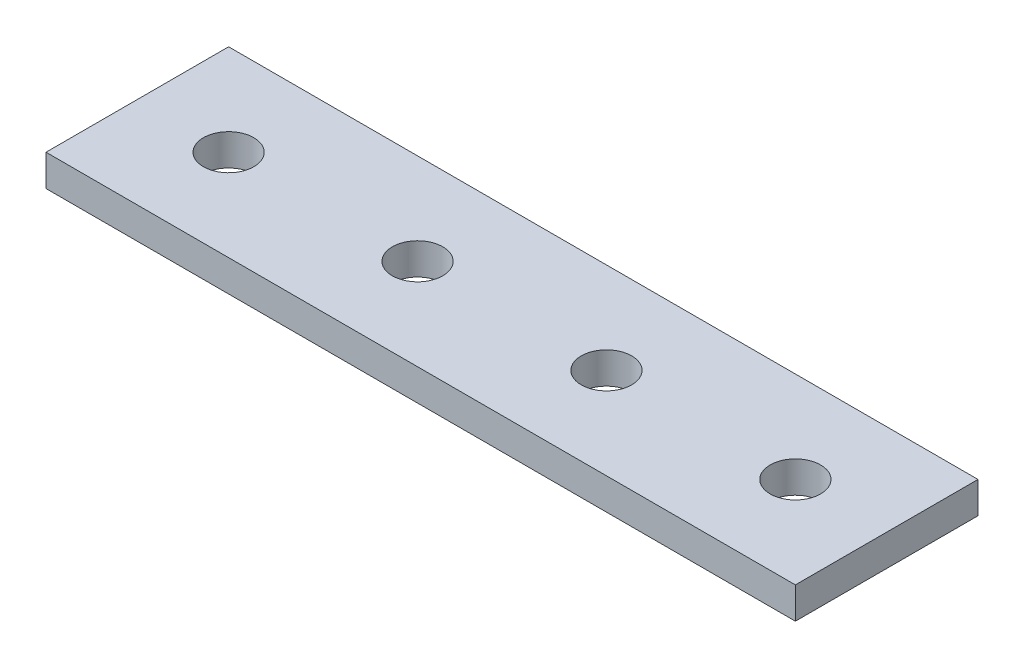
from build123d import *

# Parameters (mm, degrees)
SKETCH1_W                = 47.6
SKETCH1_H                = 5.8
BOSS_EXTRUDE1_DEPTH      = 2
M3_CLEARANCE_HOLE1_D     = 3.2
M3_CLEARANCE_HOLE1_DEPTH = 3


with BuildPart() as part:
    # Sketch1 → Boss-Extrude1 (new body)
    with BuildSketch(Plane(origin=(0, 0, 0), x_dir=(1, 0, 0), z_dir=(0, 1, 0))):
        with Locations((24, 2.9)):
            Rectangle(SKETCH1_W, SKETCH1_H)
        with Locations((24, 8.7)):
            Rectangle(SKETCH1_W, SKETCH1_H)
    extrude(amount=BOSS_EXTRUDE1_DEPTH)

    # M3 Clearance Hole1
    with Locations(Plane(origin=(0, 2, 0), x_dir=(1, 0, 0), z_dir=(0, 1, 0))):
        with Locations((42, 5.8), (30, 5.8), (18, 5.8), (6, 5.8)):
            Hole(M3_CLEARANCE_HOLE1_D / 2, depth=M3_CLEARANCE_HOLE1_DEPTH)


solid = part.part
